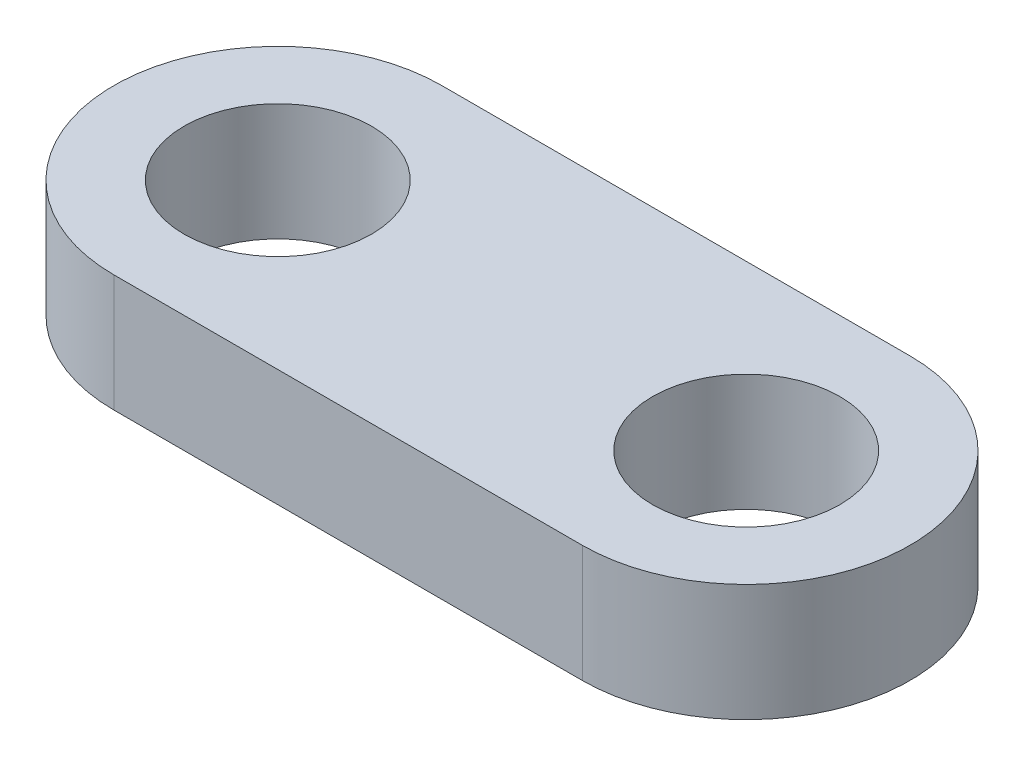
from build123d import *

# Parameters (mm, degrees)
SKETCH1_R           = 4
BOSS_EXTRUDE1_DEPTH = 2.5


with BuildPart() as part:
    # Sketch1 → Boss-Extrude1 (new, symmetric)
    with BuildSketch(Plane(origin=(0, 0, 0), x_dir=(1, 0, 0), z_dir=(0, 1, 0))):
        with BuildLine():
            Line((0, 7), (20, 7))
            ThreePointArc((20, 7), (27, 0), (20, -7))
            Line((20, -7), (0, -7))
            ThreePointArc((0, -7), (-7, 0), (0, 7))
        make_face()
        with Locations(Location((0, 0, 0), (0, 0, 270))):
            Circle(SKETCH1_R, mode=Mode.SUBTRACT)
        with Locations(Location((20, 0, 0), (0, 0, 270))):
            Circle(SKETCH1_R, mode=Mode.SUBTRACT)
    extrude(amount=BOSS_EXTRUDE1_DEPTH, both=True)


solid = part.part
